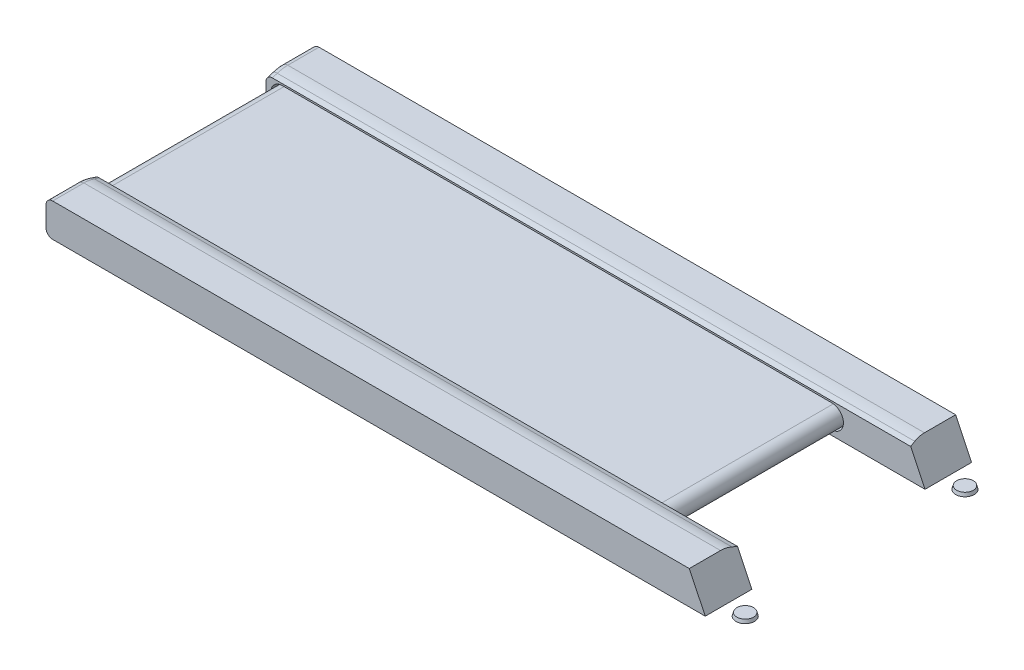
from build123d import *

# Parameters (mm, degrees)
BOSS_EXTRUDE1_DEPTH            = 140
CHAMFER1_SIZE                  = 10
CHAMFER1_SIZE2                 = 30
FILLET1_R                      = 100
FILLET2_R                      = 20
CUT_EXTRUDE1_DEPTH             = 380
CUT_EXTRUDE1_DEPTH_BACK        = 380
BOSS_EXTRUDE4_DEPTH            = 760
SKETCH31_R                     = 25
BOSS_EXTRUDE13_DEPTH           = 10
BOSS_EXTRUDE13_DRAFT           = -15
BOSS_EXTRUDE13_PROFILE_2_DEPTH = 10
BOSS_EXTRUDE13_PROFILE_2_DRAFT = -15
BOSS_EXTRUDE13_PROFILE_3_DEPTH = 10
BOSS_EXTRUDE13_PROFILE_3_DRAFT = -15
BOSS_EXTRUDE13_PROFILE_4_DEPTH = 10
BOSS_EXTRUDE13_PROFILE_4_DRAFT = -15


with BuildPart() as part:
    # Sketch2 → Boss-Extrude1 (new body)
    with BuildSketch(Plane.XY.offset(400)):
        Polygon((-1040, 0), (940, 0), (892, 100), (-1040, 100), align=None)
    extrude(amount=-BOSS_EXTRUDE1_DEPTH)

    # Chamfer1
    chamfer1_edges = [part.edges().sort_by_distance(p)[0] for p in [
        (-74, 100, 260),
    ]]
    chamfer1_side = [part.faces().sort_by_distance(p)[0] for p in [
        (-61.950920245, 49.795501022, 260),
    ]]
    chamfer(chamfer1_edges, length=CHAMFER1_SIZE, length2=CHAMFER1_SIZE2, reference=chamfer1_side[0])

    # Fillet1
    fillet1_edges = [part.edges().sort_by_distance(p)[0] for p in [
        (-74, 100, 290),
    ]]
    fillet(fillet1_edges, radius=FILLET1_R)

    # Fillet2
    fillet2_edges = [part.edges().sort_by_distance(p)[0] for p in [
        (-1040, 100, 353.113883008),
        (-1040, 92.434164903, 267.302494708),
        (-1040, 98.708745764, 290.209541716),
        (-1040, 0, 330),
    ]]
    fillet(fillet2_edges, radius=FILLET2_R)


with BuildPart() as body_2:
    # Mirror2: mirrored copy
    add(part.part.mirror(Plane.XY))


with BuildPart() as cut_extrude1_tool:
    # Sketch12 → Cut-Extrude1 (new, two sides: drawn at the far end of the back side and taken through both)
    with BuildSketch(Plane.XY.offset(-CUT_EXTRUDE1_DEPTH_BACK)):
        with BuildLine():
            Line((-990, 85), (660, 85))
            ThreePointArc((660, 85), (695, 50), (660, 15))
            Line((660, 15), (-990, 15))
            ThreePointArc((-990, 15), (-1025, 50), (-990, 85))
        make_face()
    extrude(amount=CUT_EXTRUDE1_DEPTH + CUT_EXTRUDE1_DEPTH_BACK)


with BuildPart() as part_1:
    add(part.part)

    # Cut-Extrude1: cut by cut_extrude1_tool
    add(cut_extrude1_tool.part, mode=Mode.SUBTRACT)


with BuildPart() as body_2_1:
    add(body_2.part)

    # Cut-Extrude1: cut by cut_extrude1_tool
    add(cut_extrude1_tool.part, mode=Mode.SUBTRACT)


with BuildPart() as body_3:
    # Sketch13 → Boss-Extrude4 (new body)
    with BuildSketch(Plane.XY.offset(-380)):
        with BuildLine():
            Line((-990, 20), (660, 20))
            ThreePointArc((660, 20), (690, 50), (660, 80))
            Line((660, 80), (-990, 80))
            ThreePointArc((-990, 80), (-1020, 50), (-990, 20))
        make_face()
        with BuildLine():
            Line((-990, 25), (660, 25))
            ThreePointArc((660, 25), (685, 50), (660, 75))
            Line((660, 75), (-990, 75))
            ThreePointArc((-990, 75), (-1015, 50), (-990, 25))
        make_face(mode=Mode.SUBTRACT)
    extrude(amount=BOSS_EXTRUDE4_DEPTH)


with BuildPart() as body_4:
    # Sketch31 → Boss-Extrude13 (with draft: the straight prism first)
    with BuildSketch(Plane.XZ):
        with Locations((-990, 330)):
            Circle(SKETCH31_R)
    extrude(amount=BOSS_EXTRUDE13_DEPTH)
    # Boss-Extrude13: the draft: its side faces are tilted about the plane it starts from
    boss_extrude13_sides = [body_4.faces().sort_by_distance(p)[0] for p in [
        (-1015, -5, 330),
    ]]
    draft(boss_extrude13_sides, Plane.XZ, BOSS_EXTRUDE13_DRAFT)


with BuildPart() as body_5:
    # Sketch31 → Boss-Extrude13 profile 2 (with draft: the straight prism first)
    with BuildSketch(Plane.XZ):
        with Locations((-990, -330)):
            Circle(SKETCH31_R)
    extrude(amount=BOSS_EXTRUDE13_PROFILE_2_DEPTH)
    # Boss-Extrude13 profile 2: the draft: its side faces are tilted about the plane it starts from
    boss_extrude13_profile_2_sides = [body_5.faces().sort_by_distance(p)[0] for p in [
        (-1015, -5, -330),
    ]]
    draft(boss_extrude13_profile_2_sides, Plane.XZ, BOSS_EXTRUDE13_PROFILE_2_DRAFT)


with BuildPart() as body_6:
    # Sketch31 → Boss-Extrude13 profile 3 (with draft: the straight prism first)
    with BuildSketch(Plane.XZ):
        with Locations((990, -330)):
            Circle(SKETCH31_R)
    extrude(amount=BOSS_EXTRUDE13_PROFILE_3_DEPTH)
    # Boss-Extrude13 profile 3: the draft: its side faces are tilted about the plane it starts from
    boss_extrude13_profile_3_sides = [body_6.faces().sort_by_distance(p)[0] for p in [
        (965, -5, -330),
    ]]
    draft(boss_extrude13_profile_3_sides, Plane.XZ, BOSS_EXTRUDE13_PROFILE_3_DRAFT)


with BuildPart() as body_7:
    # Sketch31 → Boss-Extrude13 profile 4 (with draft: the straight prism first)
    with BuildSketch(Plane.XZ):
        with Locations((990, 330)):
            Circle(SKETCH31_R)
    extrude(amount=BOSS_EXTRUDE13_PROFILE_4_DEPTH)
    # Boss-Extrude13 profile 4: the draft: its side faces are tilted about the plane it starts from
    boss_extrude13_profile_4_sides = [body_7.faces().sort_by_distance(p)[0] for p in [
        (965, -5, 330),
    ]]
    draft(boss_extrude13_profile_4_sides, Plane.XZ, BOSS_EXTRUDE13_PROFILE_4_DRAFT)


solid = Compound([part_1.part, body_2_1.part, body_3.part, body_4.part, body_5.part, body_6.part, body_7.part])
